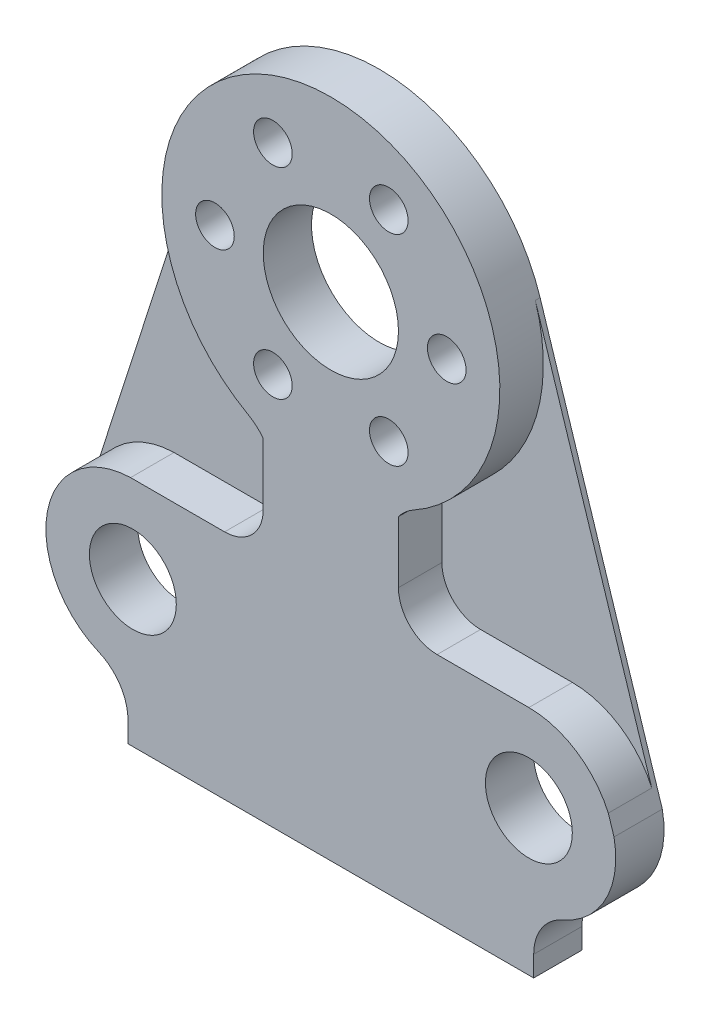
from build123d import *

# Parameters (mm, degrees)
SKETCH1_R           = 9
SKETCH1_R_2         = 4
SKETCH1_R_3         = 14
BOSS_EXTRUDE1_DEPTH = 10
BOSS_EXTRUDE2_DEPTH = 1


with BuildPart() as part:
    # Sketch1 → Boss-Extrude1 (new body)
    with BuildSketch(Plane.XY):
        with BuildLine():
            Line((-22, -54), (-41.469262149, -54))
            ThreePointArc((-41.469262149, -54), (-58.686185522, -68.620791716), (-48.072286471, -88.559075187))
            ThreePointArc((-48.072286471, -88.559075187), (-43.655027403, -92.245315871), (-42, -97.755436773))
            Line((-42, -97.755436773), (-42, -102))
            Line((-42, -102), (42, -102))
            Line((42, -102), (42, -97.748786379))
            ThreePointArc((42, -97.748786379), (43.654770396, -92.239054729), (48.071428571, -88.552791244))
            ThreePointArc((48.071428571, -88.552791244), (56.944278467, -80.353441457), (58.634486701, -68.391000304))
            Line((58.634486701, -68.391000304), (57.453450889, -64.700414132))
            ThreePointArc((57.453450889, -64.700414132), (50.813446244, -56.910391893), (41, -54))
            Line((41, -54), (22, -54))
            ThreePointArc((22, -54), (16.343145751, -51.656854249), (14, -46))
            Line((14, -46), (14, -33.255572853))
            ThreePointArc((14, -33.255572853), (15.413257736, -31.731290406), (17.111111111, -30.532112219))
            ThreePointArc((17.111111111, -30.532112219), (0, 35), (-17.111111111, -30.532112219))
            ThreePointArc((-17.111111111, -30.532112219), (-15.413257736, -31.731290406), (-14, -33.255572853))
            Line((-14, -33.255572853), (-14, -46))
            ThreePointArc((-14, -46), (-16.343145751, -51.656854249), (-22, -54))
        make_face()
        with Locations((-41, -72)):
            Circle(SKETCH1_R, mode=Mode.SUBTRACT)
        with Locations((41, -72)):
            Circle(SKETCH1_R, mode=Mode.SUBTRACT)
        with Locations((12, 20.784609691)):
            Circle(SKETCH1_R_2, mode=Mode.SUBTRACT)
        with Locations((-12, -20.784609691)):
            Circle(SKETCH1_R_2, mode=Mode.SUBTRACT)
        with Locations((-24, 0)):
            Circle(SKETCH1_R_2, mode=Mode.SUBTRACT)
        with Locations((-12, 20.784609691)):
            Circle(SKETCH1_R_2, mode=Mode.SUBTRACT)
        with Locations((12, -20.784609691)):
            Circle(SKETCH1_R_2, mode=Mode.SUBTRACT)
        Circle(SKETCH1_R_3, mode=Mode.SUBTRACT)
        with Locations((24, 0)):
            Circle(SKETCH1_R_2, mode=Mode.SUBTRACT)
    extrude(amount=BOSS_EXTRUDE1_DEPTH)

    # Sketch1<3> → Boss-Extrude2 (add)
    with BuildSketch(Plane.XY):
        with BuildLine():
            ThreePointArc((-58.141884058, -66.488555733), (-51.79486562, -57.58850864), (-41.469262149, -54))
            Line((-41.469262149, -54), (-22, -54))
            ThreePointArc((-22, -54), (-16.343145751, -51.656854249), (-14, -46))
            Line((-14, -46), (-14, -33.255572853))
            ThreePointArc((-14, -33.255572853), (-15.413257736, -31.731290406), (-17.111111111, -30.532112219))
            ThreePointArc((-17.111111111, -30.532112219), (-32.56606191, -12.823868827), (-33.334718679, 10.667545668))
            Line((-33.334718679, 10.667545668), (-58.141884058, -66.488555733))
        make_face()
        with BuildLine():
            Line((57.453450889, -64.700414132), (33.334718679, 10.667545668))
            ThreePointArc((33.334718679, 10.667545668), (32.56606191, -12.823868827), (17.111111111, -30.532112219))
            ThreePointArc((17.111111111, -30.532112219), (15.413257736, -31.731290406), (14, -33.255572853))
            Line((14, -33.255572853), (14, -46))
            ThreePointArc((14, -46), (16.343145751, -51.656854249), (22, -54))
            Line((22, -54), (41, -54))
            ThreePointArc((41, -54), (50.813446244, -56.910391893), (57.453450889, -64.700414132))
        make_face()
    extrude(amount=BOSS_EXTRUDE2_DEPTH)


solid = part.part
